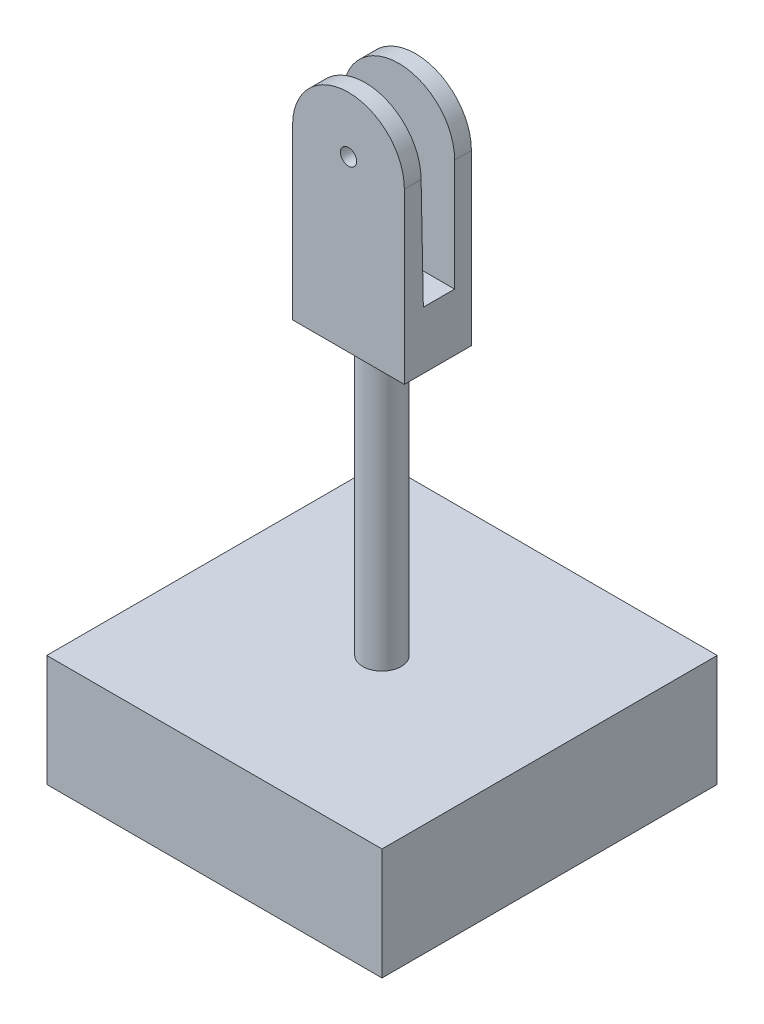
from build123d import *

# Parameters (mm, degrees)
SKETCH_1_R          = 1.45
EXTRUDE_1_DEPTH     = 12
CUT_EXTRUDE_1_DEPTH = 39.218600963
EXTRUDE_2_DEPTH     = 50
SKETCH_4_W          = 60
SKETCH_4_H          = 60
SKETCH_4_R          = 3.45
EXTRUDE_3_DEPTH     = 20


with BuildPart() as part:
    # 草圖1 → 填料-伸長1 (new body)
    with BuildSketch(Plane.XY):
        with BuildLine():
            Line((-10, 0), (-10, -30.276417548))
            Line((-10, -30.276417548), (10, -30.276417548))
            Line((10, -30.276417548), (10, 0))
            ThreePointArc((10, 0), (0, 10), (-10, 0))
        make_face()
        Circle(SKETCH_1_R, mode=Mode.SUBTRACT)
    extrude(amount=EXTRUDE_1_DEPTH)

    # 草圖2 → 除料-伸長1 (cut, through all)
    with BuildSketch(Plane(origin=(10, 0, 0), x_dir=(0, 0, -1), z_dir=(1, 0, 0))):
        Polygon((-9, 0), (-6, 0), (-3, 0), (-3, 15.780779257), (-9, 15.780779257), align=None)
        Polygon((-3, 0), (-6, 0), (-9, 0), (-8.60053373, -20), (-3, -20), align=None)
    extrude(amount=-CUT_EXTRUDE_1_DEPTH, mode=Mode.SUBTRACT)

    # 草圖3 → 填料-伸長2 (add)
    with BuildSketch(Plane.XZ.offset(30.276417548)):
        with BuildLine():
            ThreePointArc((-3.45, 6), (0, 2.55), (3.45, 6))
            Line((3.45, 6), (-3.45, 6))
        make_face()
        with BuildLine():
            Line((-3.45, 6), (3.45, 6))
            ThreePointArc((3.45, 6), (0, 9.45), (-3.45, 6))
        make_face()
    extrude(amount=EXTRUDE_2_DEPTH)


with BuildPart() as body_2:
    # 草圖4 → 填料-伸長3 (new body)
    with BuildSketch(Plane.XZ.offset(80.276417548)):
        with Locations((0, 6)):
            Rectangle(SKETCH_4_W, SKETCH_4_H)
        with Locations(Location((0, 6, 0), (0, 0, 270))):
            Circle(SKETCH_4_R, mode=Mode.SUBTRACT)
    extrude(amount=EXTRUDE_3_DEPTH)


solid = Compound([part.part, body_2.part])
